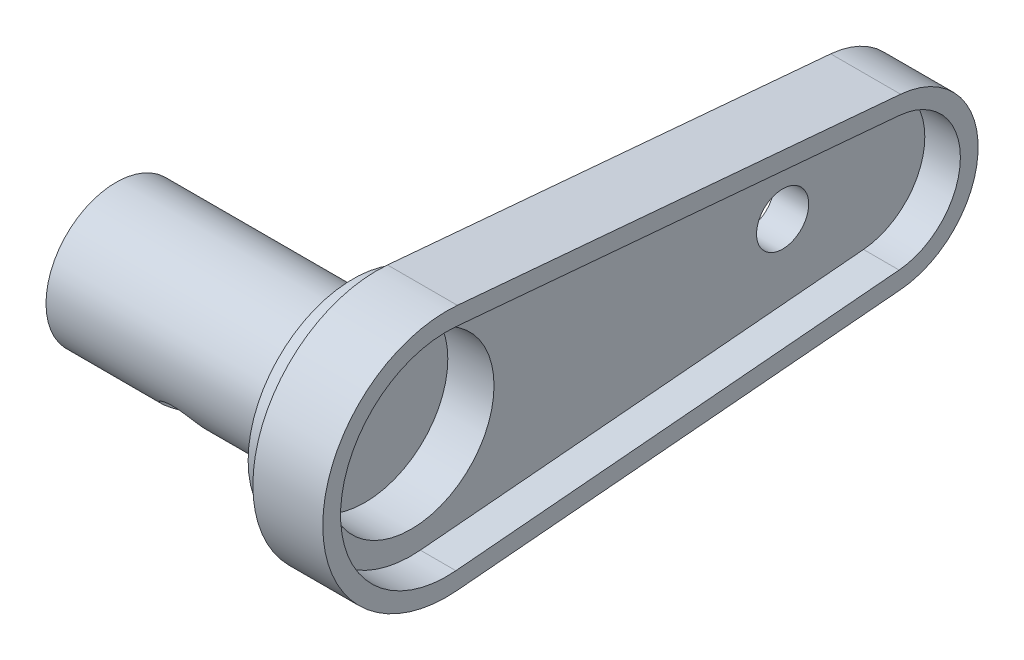
from build123d import *

# Parameters (mm, degrees)
BOSS_EXTRUDE1_DEPTH = 2.9972
SKETCH2_R           = 3
BOSS_EXTRUDE2_DEPTH = 11.176
SKETCH3_R           = 4.4958
BOSS_EXTRUDE3_DEPTH = 1.016
CUT_EXTRUDE1_DEPTH  = 1.524
SKETCH5_R           = 3.556
CUT_EXTRUDE2_DEPTH  = 1.9812
SKETCH6_R           = 1.1176
CUT_EXTRUDE3_DEPTH  = 32.262860272
SKETCH9_R           = 0.9906
CUT_EXTRUDE4_DEPTH  = 10.16
SCALE1_SCALE        = 0.6


with BuildPart() as part:
    # Sketch1 → Boss-Extrude1 (new body)
    with BuildSketch(Plane(origin=(0, 0, 0), x_dir=(0, 0, -1), z_dir=(1, 0, 0))):
        with BuildLine():
            Line((24.769539012, 3.626266444), (5.771274976, 5.288399174))
            ThreePointArc((5.771274976, 5.288399174), (0, 0), (5.771274976, -5.288399174))
            Line((5.771274976, -5.288399174), (24.769539012, -3.626266444))
            ThreePointArc((24.769539012, -3.626266444), (28.0924, 0), (24.769539012, 3.626266444))
        make_face()
    extrude(amount=BOSS_EXTRUDE1_DEPTH)

    # Sketch2 → Boss-Extrude2 (add)
    with BuildSketch(Plane.ZY):
        with Locations(Location((-5.3086, 0, 0), (0, 0, 180))):
            Circle(SKETCH2_R)
    extrude(amount=BOSS_EXTRUDE2_DEPTH)

    # Sketch3 → Boss-Extrude3 (add)
    with BuildSketch(Plane.ZY):
        with Locations(Location((-5.3086, 0, 0), (0, 0, 180))):
            Circle(SKETCH3_R)
    extrude(amount=BOSS_EXTRUDE3_DEPTH)

    # Sketch4 → Cut-Extrude1 (cut)
    with BuildSketch(Plane(origin=(2.9972, 0, 0), x_dir=(0, 0, -1), z_dir=(1, 0, 0))):
        with BuildLine():
            Line((24.703126336, 2.867166085), (5.7048623, 4.529298814))
            ThreePointArc((5.7048623, 4.529298814), (0.762, 0), (5.7048623, -4.529298814))
            Line((5.7048623, -4.529298814), (24.703126336, -2.867166085))
            ThreePointArc((24.703126336, -2.867166085), (27.3304, 0), (24.703126336, 2.867166085))
        make_face()
    extrude(amount=-CUT_EXTRUDE1_DEPTH, mode=Mode.SUBTRACT)

    # Sketch5 → Cut-Extrude2 (cut)
    with BuildSketch(Plane(origin=(1.4732, 0, 0), x_dir=(0, 0, -1), z_dir=(1, 0, 0))):
        with Locations((5.3086, 0)):
            Circle(SKETCH5_R)
    extrude(amount=-CUT_EXTRUDE2_DEPTH, mode=Mode.SUBTRACT)

    # Sketch6 → Cut-Extrude3 (cut, through all)
    with BuildSketch(Plane(origin=(1.4732, 0, 0), x_dir=(0, 0, -1), z_dir=(1, 0, 0))):
        with Locations((21.2344, 0)):
            Circle(SKETCH6_R)
    extrude(amount=-CUT_EXTRUDE3_DEPTH, mode=Mode.SUBTRACT)

    # Sketch9 → Cut-Extrude4 (cut)
    with BuildSketch(Plane(origin=(0, 4.943430386, -8.562272593), x_dir=(-1, 0, 0), z_dir=(0, 0.5000000000000044, -0.866025403784436))):
        with Locations(Location((6.134133556, -3.622041732, 0), (0, 0, 90))):
            Circle(SKETCH9_R)
    extrude(amount=-CUT_EXTRUDE4_DEPTH, mode=Mode.SUBTRACT)


with BuildPart() as part_1:
    # Scale1: scaled about (-1.924771694, 0.020710346, -10.183561465)
    add(part.part.scale(SCALE1_SCALE).moved(Location((-0.769908678, 0.008284138, -4.073424586))))


solid = part_1.part
